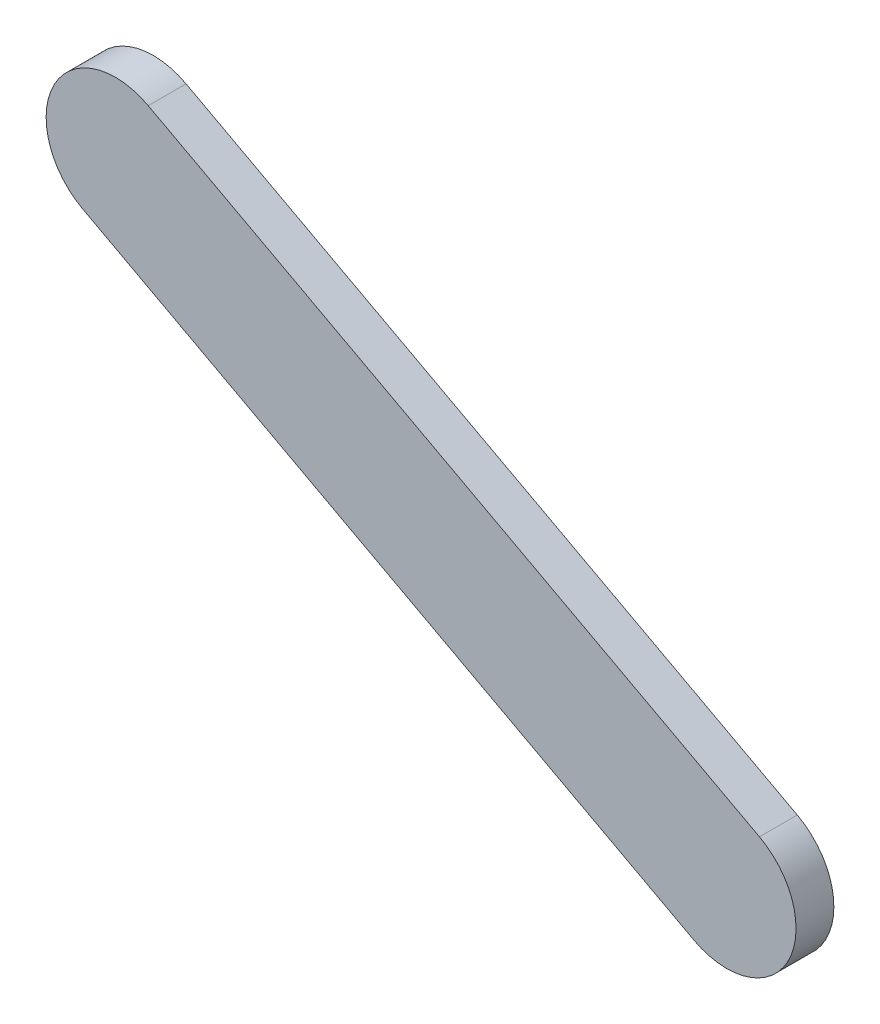
from build123d import *

# Parameters (mm, degrees)
BOSS_EXTRUDE1_DEPTH = 1.5


with BuildPart() as part:
    # Sketch1-Link1<3> → Boss-Extrude1 (new, symmetric)
    with BuildSketch(Plane.XY):
        with BuildLine():
            Line((17.598076211, 30.828441971), (66.074874786, 4.847679857))
            ThreePointArc((66.074874786, 4.847679857), (68.324478432, -2.598076211), (60.878722363, -4.847679857))
            Line((60.878722363, -4.847679857), (12.401923789, 21.133082256))
            ThreePointArc((12.401923789, 21.133082256), (10.152320143, 28.578838325), (17.598076211, 30.828441971))
        make_face()
    extrude(amount=BOSS_EXTRUDE1_DEPTH, both=True)


solid = part.part
